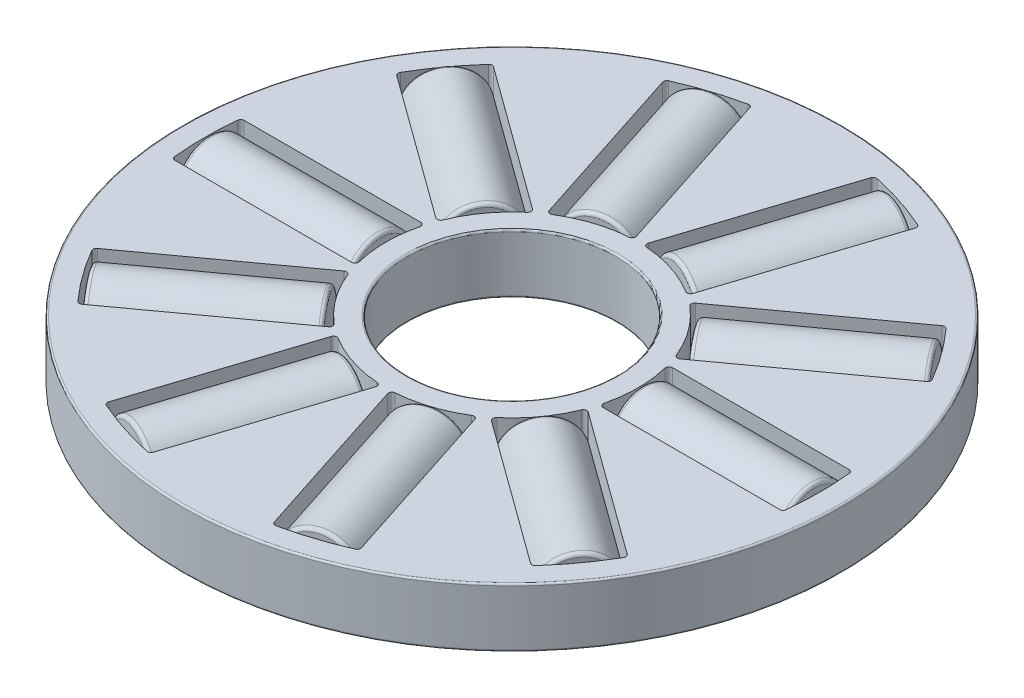
from build123d import *

# Parameters (mm, degrees)
SKETCH3_W                = 6.49
SKETCH3_H                = 1.7
FILLET1_R                = 0.05
CUT_EXTRUDE1_DEPTH       = 14.461890796
FILLET5_R                = 0.1
CIRPATTERN1_COUNT        = 10
FILLET5_OF_CIRPATTERN1_R = 0.1
SKETCH5_W                = 4.96375
SKETCH5_H                = 0.997879395
FILLET6_R                = 0.1
CIRPATTERN2_COUNT        = 10


with BuildPart() as part:
    # Sketch3 → Revolve1 (revolve)
    with BuildSketch(Plane(origin=(0, 0, 0), x_dir=(0, 0, -1), z_dir=(1, 0, 0))):
        with Locations((6.255, 0)):
            Rectangle(SKETCH3_W, SKETCH3_H)
    revolve(axis=Axis((0, 1, 0), (0, -1, 0)))

    # Fillet1
    fillet1_edges = [part.edges().sort_by_distance(p)[0] for p in [
        (0, -0.85, 3.01),
        (0, -0.85, 9.5),
        (0, 0.85, 9.5),
        (0, 0.85, 3.01),
    ]]
    fillet(fillet1_edges, radius=FILLET1_R)

    # Sketch4 → Cut-Extrude1 (cut, symmetric)
    with BuildSketch(Plane(origin=(0, 0, 0), x_dir=(1, 0, 0), z_dir=(0, 1, 0))):
        with BuildLine():
            Line((3.497948393, 0.997879395), (8.806142343, 0.997879395))
            ThreePointArc((8.806142343, 0.997879395), (8.8625, 0), (8.806142343, -0.997879395))
            Line((8.806142343, -0.997879395), (3.497948393, -0.997879395))
            ThreePointArc((3.497948393, -0.997879395), (3.6375, 0), (3.497948393, 0.997879395))
        make_face()
    cut_extrude1 = extrude(amount=CUT_EXTRUDE1_DEPTH, both=True, mode=Mode.SUBTRACT)

    # Fillet5
    fillet5_edges = [part.edges().sort_by_distance(p)[0] for p in [
        (8.806142343, 0, -0.997879395),
        (8.806142343, 0, 0.997879395),
        (3.497948393, 0, -0.997879395),
        (3.497948393, 0, 0.997879395),
    ]]
    fillet(fillet5_edges, radius=FILLET5_R)

    # CirPattern1: Cut-Extrude1 ×10 about axis
    cirpattern1_axis = Axis((0, 1, 0), (0, -1, 0))
    for i in range(1, CIRPATTERN1_COUNT):
        add(cut_extrude1.rotate(cirpattern1_axis, i * 360 / CIRPATTERN1_COUNT), mode=Mode.SUBTRACT)

    # Fillet5 of CirPattern1
    fillet5_of_cirpattern1_edges = [part.edges().sort_by_distance(p)[0] for p in [
        (7.710857602, 0, 4.36881921),
        (6.537780018, 0, 5.983421988),
        (3.416438488, 0, 1.24874109),
        (2.243360904, 0, 2.863343868),
        (3.67028734, 0, 8.066777367),
        (1.772207938, 0, 8.68350075),
        (2.0299652, 0, 3.018384922),
        (0.131885798, 0, 3.635108305),
        (-1.772207938, 0, 8.68350075),
        (-3.67028734, 0, 8.066777367),
        (-0.131885798, 0, 3.635108305),
        (-2.0299652, 0, 3.018384922),
        (-6.537780018, 0, 5.983421988),
        (-7.710857602, 0, 4.36881921),
        (-2.243360904, 0, 2.863343868),
        (-3.416438488, 0, 1.24874109),
        (-8.806142343, 0, 0.997879395),
        (-8.806142343, 0, -0.997879395),
        (-3.497948393, 0, 0.997879395),
        (-3.497948393, 0, -0.997879395),
        (-7.710857602, 0, -4.36881921),
        (-6.537780018, 0, -5.983421988),
        (-3.416438488, 0, -1.24874109),
        (-2.243360904, 0, -2.863343868),
        (-3.67028734, 0, -8.066777367),
        (-1.772207938, 0, -8.68350075),
        (-2.0299652, 0, -3.018384922),
        (-0.131885798, 0, -3.635108305),
        (1.772207938, 0, -8.68350075),
        (3.67028734, 0, -8.066777367),
        (0.131885798, 0, -3.635108305),
        (2.0299652, 0, -3.018384922),
        (6.537780018, 0, -5.983421988),
        (7.710857602, 0, -4.36881921),
        (2.243360904, 0, -2.863343868),
        (3.416438488, 0, -1.24874109),
    ]]
    fillet(fillet5_of_cirpattern1_edges, radius=FILLET5_OF_CIRPATTERN1_R)


with BuildPart() as body_2:
    # Sketch5 → Revolve2 (revolve)
    with BuildSketch(Plane(origin=(0, 0, 0), x_dir=(1, 0, 0), z_dir=(0, 1, 0))):
        with Locations((6.25, 0.498939698)):
            Rectangle(SKETCH5_W, SKETCH5_H)
    revolve(axis=Axis((8.8625, 0, 0), (-1, 0, 0)))

    # Fillet6
    fillet6_edges = [body_2.edges().sort_by_distance(p)[0] for p in [
        (3.768125, 0, 0.997879395),
        (8.731875, 0, 0.997879395),
    ]]
    fillet(fillet6_edges, radius=FILLET6_R)


with BuildPart() as cirpattern2_1:
    # CirPattern2: pattern copy
    add(body_2.part.rotate(Axis((0, 1, 0), (0, -1, 0)), 1 * 360 / CIRPATTERN2_COUNT))


with BuildPart() as cirpattern2_2:
    # CirPattern2: pattern copy
    add(body_2.part.rotate(Axis((0, 1, 0), (0, -1, 0)), 2 * 360 / CIRPATTERN2_COUNT))


with BuildPart() as cirpattern2_3:
    # CirPattern2: pattern copy
    add(body_2.part.rotate(Axis((0, 1, 0), (0, -1, 0)), 3 * 360 / CIRPATTERN2_COUNT))


with BuildPart() as cirpattern2_4:
    # CirPattern2: pattern copy
    add(body_2.part.rotate(Axis((0, 1, 0), (0, -1, 0)), 4 * 360 / CIRPATTERN2_COUNT))


with BuildPart() as cirpattern2_5:
    # CirPattern2: pattern copy
    add(body_2.part.rotate(Axis((0, 1, 0), (0, -1, 0)), 5 * 360 / CIRPATTERN2_COUNT))


with BuildPart() as cirpattern2_6:
    # CirPattern2: pattern copy
    add(body_2.part.rotate(Axis((0, 1, 0), (0, -1, 0)), 6 * 360 / CIRPATTERN2_COUNT))


with BuildPart() as cirpattern2_7:
    # CirPattern2: pattern copy
    add(body_2.part.rotate(Axis((0, 1, 0), (0, -1, 0)), 7 * 360 / CIRPATTERN2_COUNT))


with BuildPart() as cirpattern2_8:
    # CirPattern2: pattern copy
    add(body_2.part.rotate(Axis((0, 1, 0), (0, -1, 0)), 8 * 360 / CIRPATTERN2_COUNT))


with BuildPart() as cirpattern2_9:
    # CirPattern2: pattern copy
    add(body_2.part.rotate(Axis((0, 1, 0), (0, -1, 0)), 9 * 360 / CIRPATTERN2_COUNT))


solid = Compound([part.part, body_2.part, cirpattern2_1.part, cirpattern2_2.part, cirpattern2_3.part, cirpattern2_4.part, cirpattern2_5.part, cirpattern2_6.part, cirpattern2_7.part, cirpattern2_8.part, cirpattern2_9.part])
